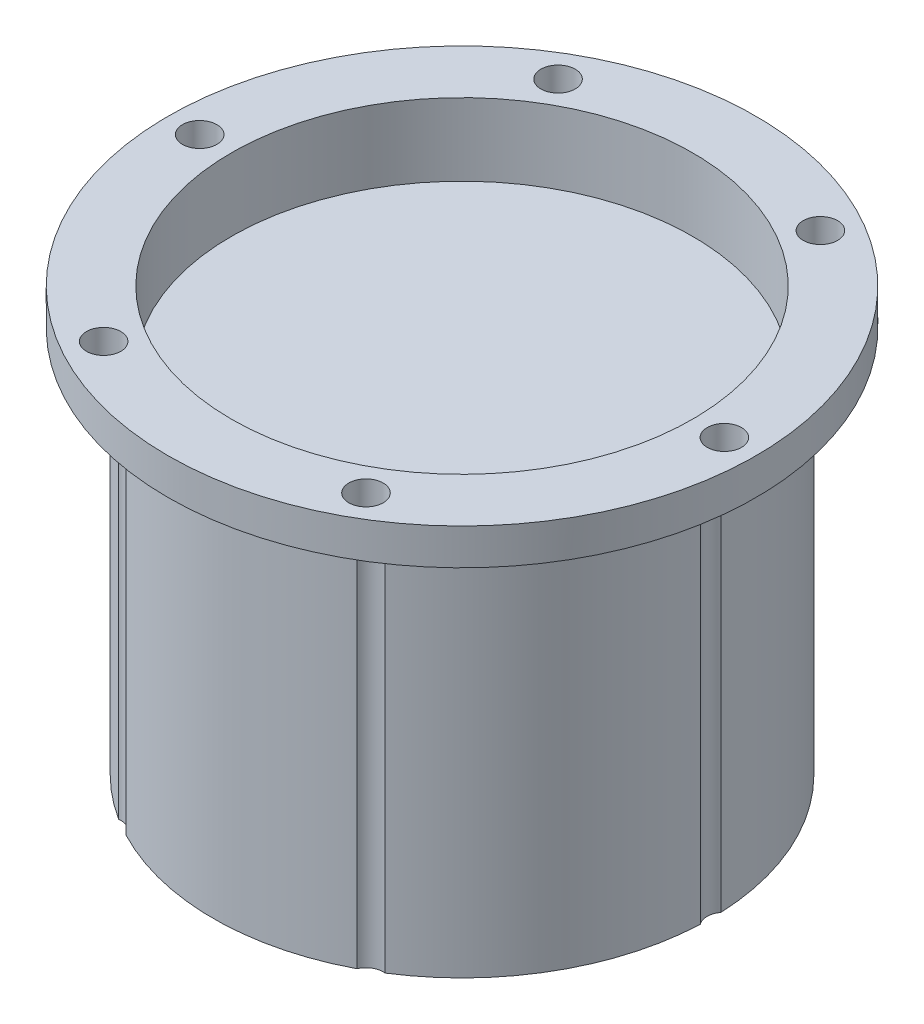
from build123d import *

# Parameters (mm, degrees)
SKETCH1_R                      = 41.275
BOSS_EXTRUDE1_DEPTH            = 59.436
CUT_EXTRUDE5_START             = -54.356
SKETCH7_R                      = 41.275
SKETCH7_R_2                    = 34.925
CUT_EXTRUDE5_DEPTH             = 54.356
TOP_INTERCONNECTION_HOLE_REACH = 85.306
SKETCH8_R                      = 2.413
CIRPATTERN1_COUNT              = 6
SKETCH9_R                      = 32.385
CUT_EXTRUDE8_DEPTH             = 10.16


with BuildPart() as part:
    # Sketch1 → Boss-Extrude1 (new body)
    with BuildSketch(Plane(origin=(0, 0, 0), x_dir=(1, 0, 0), z_dir=(0, 1, 0))):
        Circle(SKETCH1_R)
    extrude(amount=-BOSS_EXTRUDE1_DEPTH)

    # Sketch7 → Cut-Extrude5 (cut)
    with BuildSketch(Plane.XZ.offset(59.436).offset(CUT_EXTRUDE5_START)):
        Circle(SKETCH7_R)
        Circle(SKETCH7_R_2, mode=Mode.SUBTRACT)
    extrude(amount=CUT_EXTRUDE5_DEPTH, mode=Mode.SUBTRACT)

    # Sketch8 → Top Interconnection Hole (cut, up to next)
    with BuildSketch(Plane(origin=(0, 0, 0), x_dir=(1, 0, 0), z_dir=(0, 1, 0)), mode=Mode.PRIVATE) as top_interconnection_hole_sk1:
        with Locations((-36.83, 0)):
            Circle(SKETCH8_R)
    top_interconnection_hole_tool1 = extrude(top_interconnection_hole_sk1.sketch, amount=-TOP_INTERCONNECTION_HOLE_REACH, mode=Mode.PRIVATE) & part.part
    top_interconnection_hole = top_interconnection_hole_tool1.solids().sort_by_distance((-36.83, 0, 0))[0]
    add(top_interconnection_hole, mode=Mode.SUBTRACT)

    # CirPattern1: Top Interconnection Hole ×6 about axis
    cirpattern1_axis = Axis((0, 21.434496837, 0), (0, -1, 0))
    for i in range(1, CIRPATTERN1_COUNT):
        add(top_interconnection_hole.rotate(cirpattern1_axis, i * 360 / CIRPATTERN1_COUNT), mode=Mode.SUBTRACT)

    # Sketch9 → Cut-Extrude8 (cut)
    with BuildSketch(Plane(origin=(0, 0, 0), x_dir=(1, 0, 0), z_dir=(0, 1, 0))):
        Circle(SKETCH9_R)
    extrude(amount=-CUT_EXTRUDE8_DEPTH, mode=Mode.SUBTRACT)


solid = part.part
